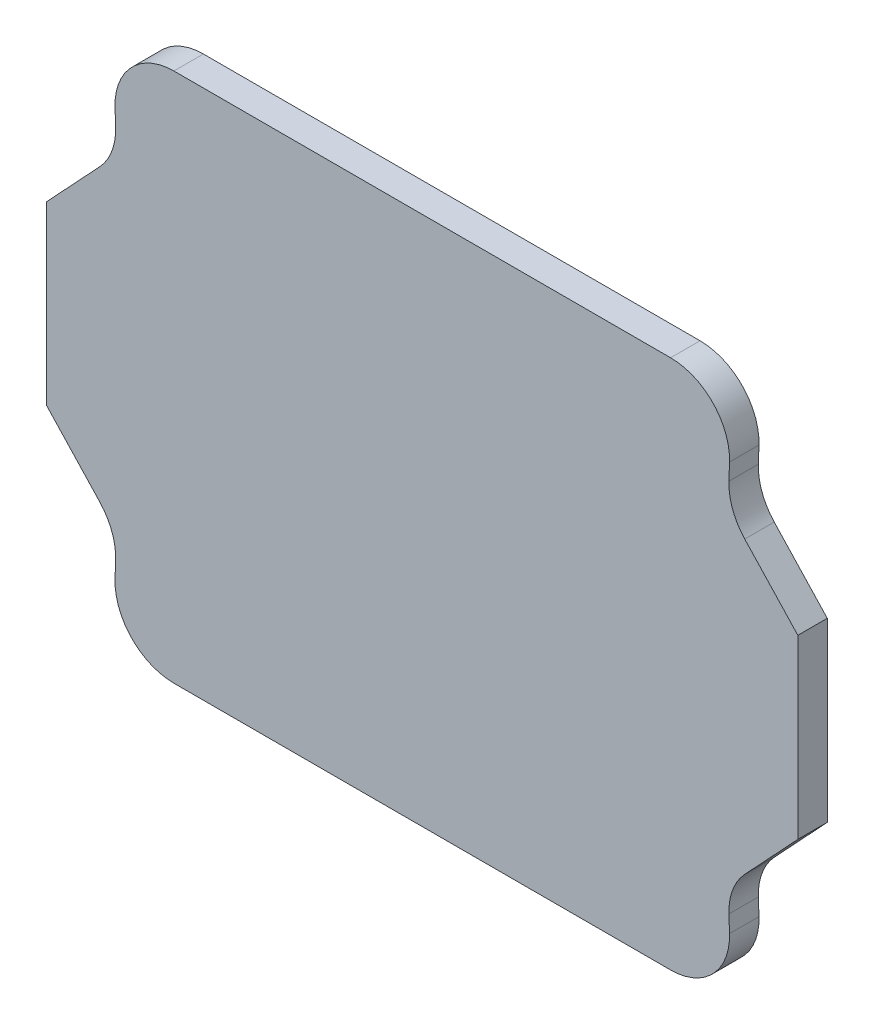
from build123d import *

# Parameters (mm, degrees)
BOSS_EXTRUDE1_DEPTH = 25.4
FILLET1_R           = 50.8


with BuildPart() as part:
    # Sketch1 → Boss-Extrude1 (new body)
    with BuildSketch(Plane.XY):
        Polygon((-266.7, 0), (266.7, 0), (263.711926547, 88.036152545), (323.85, 152.4), (323.85, 304.8), (263.711926547, 369.163847455), (266.7, 457.2), (-266.7, 457.2), (-263.711926547, 369.163847455), (-323.85, 304.8), (-323.85, 152.4), (-263.711926547, 88.036152545), align=None)
    extrude(amount=BOSS_EXTRUDE1_DEPTH)

    # Fillet1
    fillet1_edges = [part.edges().sort_by_distance(p)[0] for p in [
        (266.7, 0, 12.7),
        (-266.7, 0, 12.7),
        (-263.711926547, 88.036152545, 12.7),
        (-263.711926547, 369.163847455, 12.7),
        (-266.7, 457.2, 12.7),
        (266.7, 457.2, 12.7),
        (263.711926547, 369.163847455, 12.7),
        (263.711926547, 88.036152545, 12.7),
    ]]
    fillet(fillet1_edges, radius=FILLET1_R)


solid = part.part
